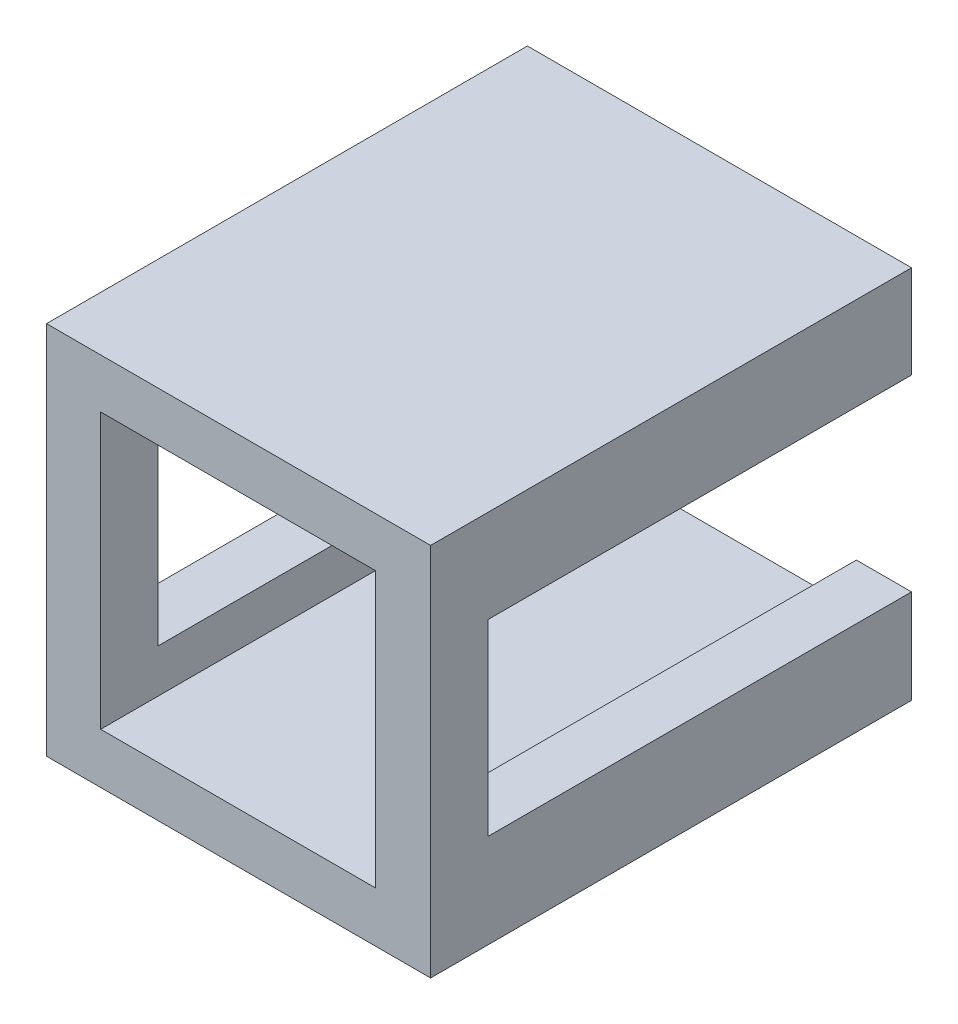
from build123d import *

# Parameters (mm, degrees)
SKETCH1_W           = 1636.029426001
SKETCH1_H           = 1677.394908568
SKETCH1_W_2         = 1200
SKETCH1_H_2         = 1200
BOSS_EXTRUDE1_DEPTH = 2100
SKETCH3_W           = 1850
SKETCH3_H           = 820
CUT_EXTRUDE1_DEPTH  = 2000


with BuildPart() as part:
    # Sketch1 → Boss-Extrude1 (new body)
    with BuildSketch(Plane(origin=(0, 0, 0), x_dir=(0, 1, 0), z_dir=(0, 0, 1))):
        with Locations((-2.249322435, -2.054950343)):
            Rectangle(SKETCH1_W, SKETCH1_H)
        Rectangle(SKETCH1_W_2, SKETCH1_H_2, mode=Mode.SUBTRACT)
    extrude(amount=BOSS_EXTRUDE1_DEPTH)

    # Sketch3 → Cut-Extrude1 (cut)
    with BuildSketch(Plane(origin=(840.752404627, 0, 0), x_dir=(0, 0, -1), z_dir=(1, 0, 0))):
        with Locations((-925, 0)):
            Rectangle(SKETCH3_W, SKETCH3_H)
    extrude(amount=-CUT_EXTRUDE1_DEPTH, mode=Mode.SUBTRACT)


solid = part.part
